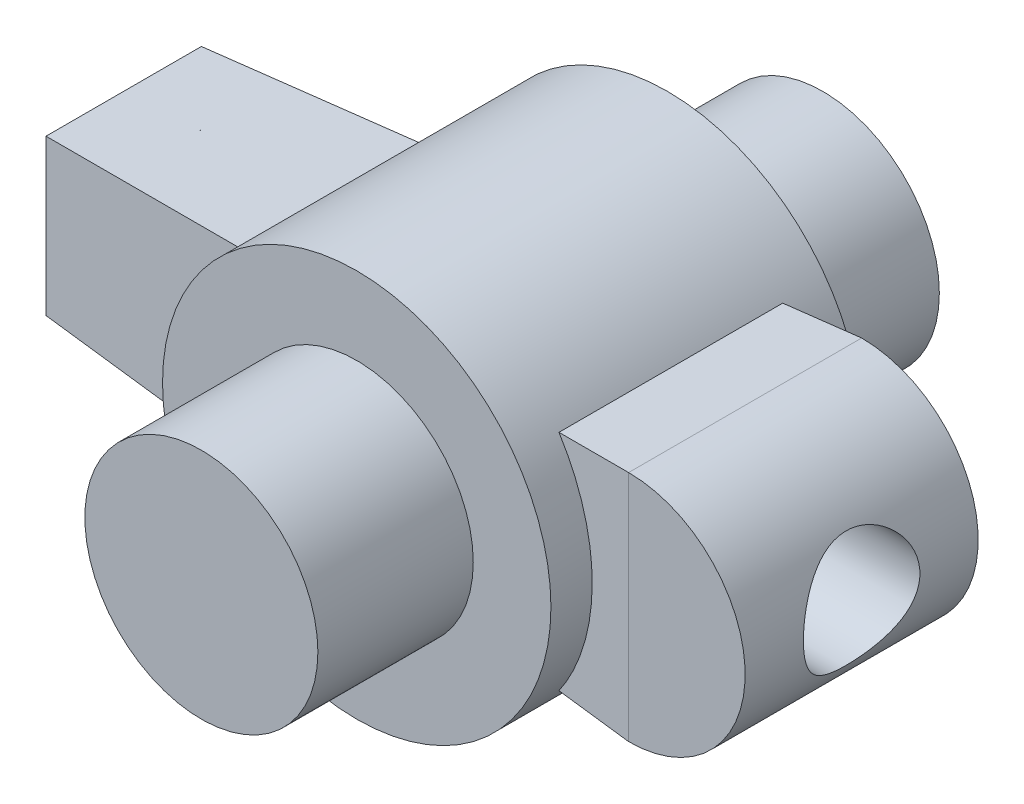
from build123d import *

# Parameters (mm, degrees)
BOSS_EXTRUDE1_DEPTH     = 15
CUT_EXTRUDE1_DEPTH      = 107.066017202
CUT_EXTRUDE1_DEPTH_BACK = 107.066017202
SKETCH8_R               = 7.5
CUT_EXTRUDE2_DEPTH      = 98.596106557
CUT_EXTRUDE2_DEPTH_BACK = 8
SKETCH9_R               = 0.75
SKETCH9_R_2             = 3


with BuildPart() as part:
    # Sketch1 → Revolve1 (revolve)
    with BuildSketch(Plane(origin=(0, 0, 0), x_dir=(0, 0, -1), z_dir=(1, 0, 0)), mode=Mode.PRIVATE) as revolve1_sk:
        Polygon((0, 0), (-40, 0), (-40, 15), (-20, 15), (-20, 25), (20, 25), (20, 15), (40, 15), (40, 0), align=None)
    revolve(revolve1_sk.sketch.rotate(Axis((0, 0, 74.697986577), (0, 0, -1)), 90), axis=Axis((0, 0, 74.697986577), (0, 0, -1)))

    # Sketch3 → Loft1 section 0
    with BuildSketch(Plane(origin=(-50, 0, 0), x_dir=(0, 0, -1), z_dir=(1, 0, 0))):
        with BuildLine():
            Line((-10, 10), (10, 10))
            Line((10, 10), (10, -10))
            Line((10, -10), (-10, -10))
            Line((-10, -10), (-10, 10))
        make_face()
    # Sketch4 → Loft1 section 1
    with BuildSketch(Plane(origin=(30, 0, 0), x_dir=(0, 0, -1), z_dir=(1, 0, 0))):
        with BuildLine():
            Line((-15, 15), (15, 15))
            Line((15, 15), (15, -15))
            Line((15, -15), (-15, -15))
            Line((-15, -15), (-15, 15))
        make_face()
    loft()

    # Sketch7 → Boss-Extrude1 (add, symmetric)
    with BuildSketch(Plane.XY):
        with BuildLine():
            Line((30, 15), (30, -15))
            ThreePointArc((30, -15), (45, 0), (30, 15))
        make_face()
    extrude(amount=BOSS_EXTRUDE1_DEPTH, both=True)

    # Sketch8 → Cut-Extrude1 (cut, two sides: drawn at the far end of the back side and taken through both)
    with BuildSketch(Plane.ZY.offset(50).offset(-CUT_EXTRUDE1_DEPTH_BACK)):
        Circle(SKETCH8_R)
    extrude(amount=CUT_EXTRUDE1_DEPTH + CUT_EXTRUDE1_DEPTH_BACK, mode=Mode.SUBTRACT)

    # Sketch9 → Cut-Extrude2 (cut, two sides: drawn at the far end of the back side and taken through both)
    with BuildSketch(Plane(origin=(0, 0, -40), x_dir=(-1, 0, 0), z_dir=(0, 0, -1)).offset(-CUT_EXTRUDE2_DEPTH_BACK)):
        with Locations(Location((0, 7.2, 0), (0, 0, 180))):
            Circle(SKETCH9_R)
        with Locations(Location((0, 10.4, 0), (0, 0, 180))):
            Circle(SKETCH9_R)
        with Locations(Location((0, 13.6, 0), (0, 0, 180))):
            Circle(SKETCH9_R)
        with Locations(Location((11.777945491, 6.8, 0), (0, 0, 180))):
            Circle(SKETCH9_R)
        with Locations(Location((9.006664199, 5.2, 0), (0, 0, 180))):
            Circle(SKETCH9_R)
        with Locations(Location((6.235382907, 3.6, 0), (0, 0, 180))):
            Circle(SKETCH9_R)
        with Locations(Location((11.777945491, -6.8, 0), (0, 0, 180))):
            Circle(SKETCH9_R)
        with Locations(Location((9.006664199, -5.2, 0), (0, 0, 180))):
            Circle(SKETCH9_R)
        with Locations(Location((6.235382907, -3.6, 0), (0, 0, 180))):
            Circle(SKETCH9_R)
        with Locations(Location((0, -13.6, 0), (0, 0, 180))):
            Circle(SKETCH9_R)
        with Locations(Location((0, -10.4, 0), (0, 0, 180))):
            Circle(SKETCH9_R)
        with Locations(Location((0, -7.2, 0), (0, 0, 180))):
            Circle(SKETCH9_R)
        with Locations(Location((-11.777945491, -6.8, 0), (0, 0, 180))):
            Circle(SKETCH9_R)
        with Locations(Location((-9.006664199, -5.2, 0), (0, 0, 180))):
            Circle(SKETCH9_R)
        with Locations(Location((-6.235382907, -3.6, 0), (0, 0, 180))):
            Circle(SKETCH9_R)
        with Locations(Location((-11.777945491, 6.8, 0), (0, 0, 180))):
            Circle(SKETCH9_R)
        with Locations(Location((-9.006664199, 5.2, 0), (0, 0, 180))):
            Circle(SKETCH9_R)
        with Locations(Location((-6.235382907, 3.6, 0), (0, 0, 180))):
            Circle(SKETCH9_R)
        with Locations(Location((0, 0, 0), (0, 0, 180))):
            Circle(SKETCH9_R_2)
    extrude(amount=CUT_EXTRUDE2_DEPTH + CUT_EXTRUDE2_DEPTH_BACK, mode=Mode.SUBTRACT)


solid = part.part
